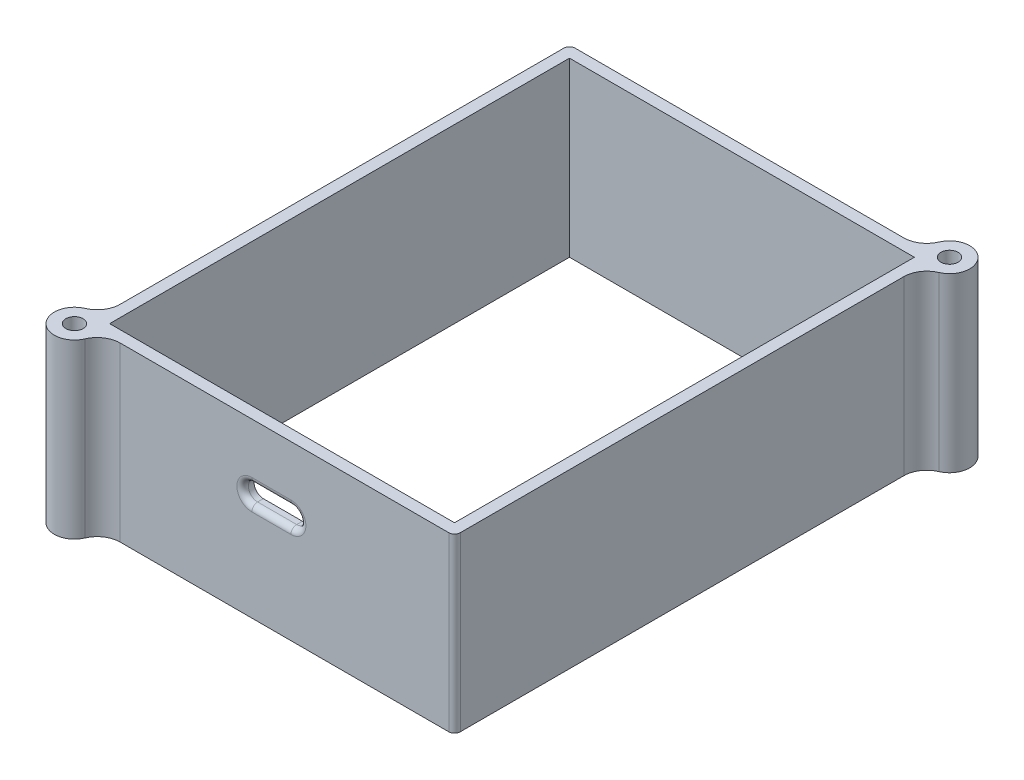
from build123d import *

# Parameters (mm, degrees)
SKETCH1_W           = 64
SKETCH1_H           = 84
SKETCH1_W_2         = 60
SKETCH1_H_2         = 80
BOSS_EXTRUDE1_DEPTH = 30
SKETCH2_R           = 3.5
SKETCH2_R_2         = 1.5
BOSS_EXTRUDE2_DEPTH = 30
CUT_EXTRUDE1_DEPTH  = 30
FILLET2_R           = 1
FILLET3_R           = 4
FILLET4_R           = 1


with BuildPart() as part:
    # Sketch1 → Boss-Extrude1 (new body)
    with BuildSketch(Plane(origin=(0, 0, 0), x_dir=(1, 0, 0), z_dir=(0, 1, 0))):
        with Locations((30, -40)):
            Rectangle(SKETCH1_W, SKETCH1_H)
        with Locations((30, -40)):
            Rectangle(SKETCH1_W_2, SKETCH1_H_2, mode=Mode.SUBTRACT)
    extrude(amount=BOSS_EXTRUDE1_DEPTH)

    # Sketch2 → Boss-Extrude2 (add)
    # profile 1 of 2: a face of its own
    with BuildSketch(Plane(origin=(0, 0, 0), x_dir=(1, 0, 0), z_dir=(0, 1, 0))):
        with Locations((-3.060660172, -83.060660172)):
            Circle(SKETCH2_R)
        with Locations(Location((-3.060660172, -83.060660172, 0), (0, 0, 270))):
            Circle(SKETCH2_R_2, mode=Mode.SUBTRACT)
    # profile 2 of 2: a face of its own
    with BuildSketch(Plane(origin=(0, 0, 0), x_dir=(1, 0, 0), z_dir=(0, 1, 0))):
        with Locations((63.060660172, 3.060660172)):
            Circle(SKETCH2_R)
        with Locations(Location((63.060660172, 3.060660172, 0), (0, 0, 270))):
            Circle(SKETCH2_R_2, mode=Mode.SUBTRACT)
    extrude(amount=BOSS_EXTRUDE2_DEPTH)

    # Sketch4 → Cut-Extrude1 (cut)
    with BuildSketch(Plane.XY.offset(82)):
        with BuildLine():
            Line((30.141314867, 20.2), (26.741314867, 20.2))
            ThreePointArc((26.741314867, 20.2), (25.141314867, 18.6), (26.741314867, 17))
            Line((26.741314867, 17), (30.141314867, 17))
            Line((30.141314867, 17), (33.541314867, 17))
            ThreePointArc((33.541314867, 17), (35.141314867, 18.6), (33.541314867, 20.2))
            Line((33.541314867, 20.2), (30.141314867, 20.2))
        make_face()
    extrude(amount=-CUT_EXTRUDE1_DEPTH, mode=Mode.SUBTRACT)

    # Fillet2
    fillet2_edges = [part.edges().sort_by_distance(p)[0] for p in [
        (30.141314867, 17, 82),
        (35.141314867, 18.6, 82),
        (30.141314867, 20.2, 82),
        (25.141314867, 18.6, 82),
    ]]
    fillet(fillet2_edges, radius=FILLET2_R)

    # Fillet3
    fillet3_edges = [part.edges().sort_by_distance(p)[0] for p in [
        (-2, 15, 79.725244156),
        (59.725244156, 15, -2),
        (0.274755844, 15, 82),
        (62, 15, 0.274755844),
    ]]
    fillet(fillet3_edges, radius=FILLET3_R)

    # Fillet4
    fillet4_edges = [part.edges().sort_by_distance(p)[0] for p in [
        (-2, 15, -2),
        (62, 15, 82),
    ]]
    fillet(fillet4_edges, radius=FILLET4_R)


solid = part.part
